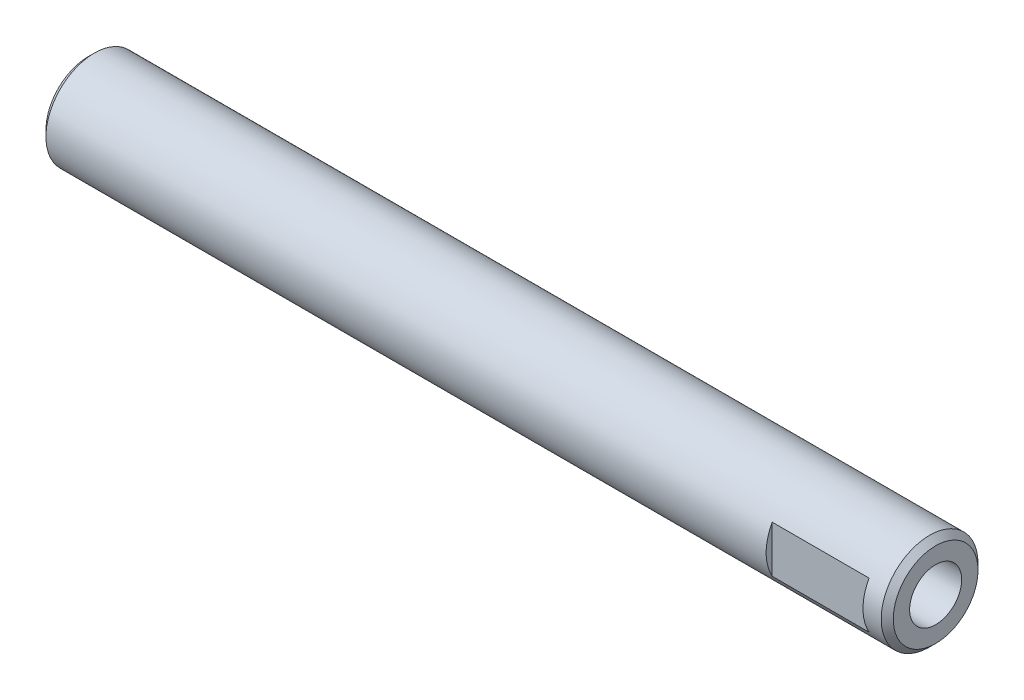
from build123d import *

# Parameters (mm, degrees)
CHAMFER_1_SIZE       = 0.5
SKETCH_2_OUTSIDE_W   = 24.182
SKETCH_2_OUTSIDE_H   = 24.182
SKETCH_2_OUTSIDE_W_2 = 7
SKETCH_2_OUTSIDE_H_2 = 8
CUT_EXTRUDE_1_DEPTH  = 8


with BuildPart() as part:
    # 草图1 → 旋转1 (revolve)
    with BuildSketch(Plane.XY, mode=Mode.PRIVATE) as revolve_1_sk:
        Polygon((-35, 2.15), (-25, 2.15), (-23.708149669, 0), (23.708149669, 0), (25, 2.15), (35, 2.15), (35, 4), (-35, 4), align=None)
    revolve(revolve_1_sk.sketch.rotate(Axis((0, 0, 0), (1, 0, 0)), 90), axis=Axis((0, 0, 0), (1, 0, 0)))

    # 倒角1
    chamfer_1_edges = [part.edges().sort_by_distance(p)[0] for p in [
        (-35, 0, -4),
        (35, 0, -4),
    ]]
    chamfer(chamfer_1_edges, length=CHAMFER_1_SIZE)

    # 草图2 outside → 切除-拉伸1 (cut)
    with BuildSketch(Plane.ZY.offset(-25)):
        Rectangle(SKETCH_2_OUTSIDE_W, SKETCH_2_OUTSIDE_H)
        Rectangle(SKETCH_2_OUTSIDE_W_2, SKETCH_2_OUTSIDE_H_2, mode=Mode.SUBTRACT)
    extrude(amount=-CUT_EXTRUDE_1_DEPTH, mode=Mode.SUBTRACT)


solid = part.part
